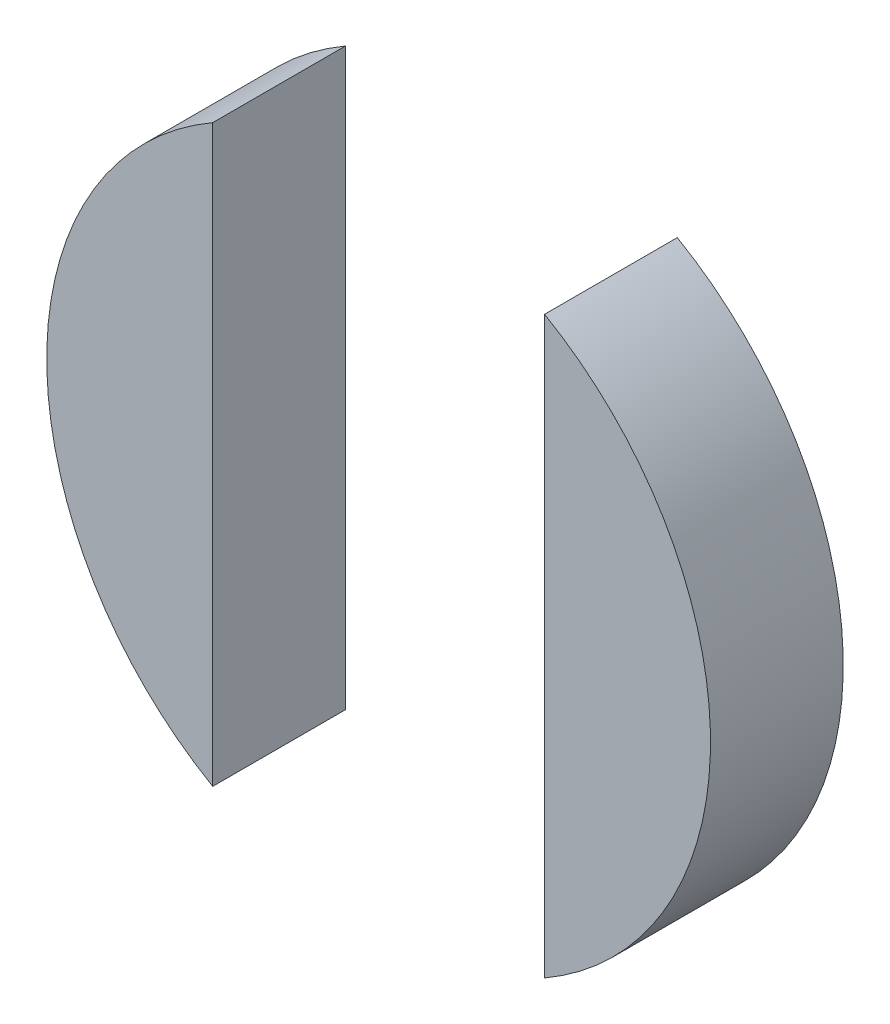
from build123d import *

# Parameters (mm, degrees)
BOSS_EXTRUDE1_DEPTH   = 4
BOSS_EXTRUDE1_2_DEPTH = 4


with BuildPart() as part:
    # Sketch1 → Boss-Extrude1 (new body)
    with BuildSketch(Plane.XY):
        with BuildLine():
            Line((-5, 8.660254038), (-5, -8.660254038))
            ThreePointArc((-5, -8.660254038), (-10, 0), (-5, 8.660254038))
        make_face()
    extrude(amount=BOSS_EXTRUDE1_DEPTH)


with BuildPart() as body_2:
    # Sketch1 → Boss-Extrude1 2 (new body)
    with BuildSketch(Plane.XY):
        with BuildLine():
            Line((5, 8.660254038), (5, -8.660254038))
            ThreePointArc((5, -8.660254038), (10, 0), (5, 8.660254038))
        make_face()
    extrude(amount=BOSS_EXTRUDE1_2_DEPTH)


solid = Compound([part.part, body_2.part])
